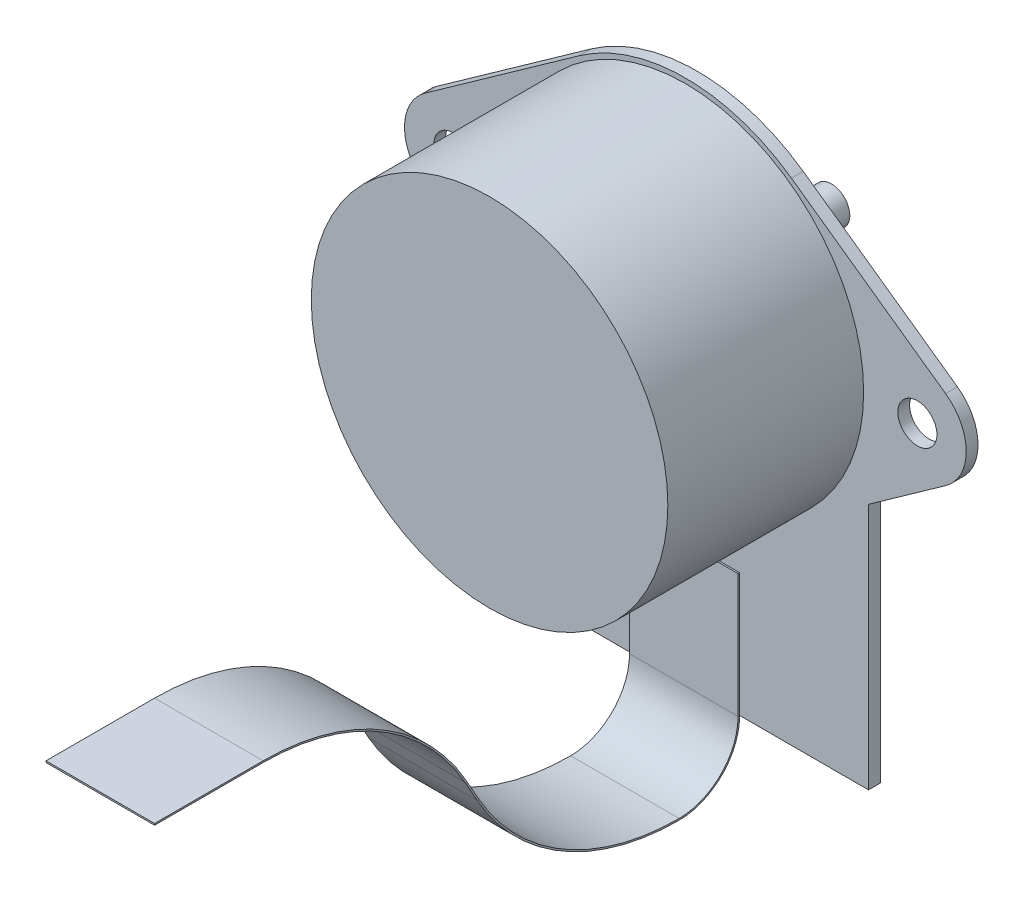
from build123d import *

# Parameters (mm, degrees)
SKETCH1_R           = 15
BOSS_EXTRUDE1_DEPTH = 0.9652
SKETCH2_R           = 1.6
BOSS_EXTRUDE2_DEPTH = 0.9652
SKETCH3_W           = 30
SKETCH3_H           = 26
BOSS_EXTRUDE3_DEPTH = 0.9652
SKETCH4_R           = 14.6
BOSS_EXTRUDE4_DEPTH = 16.0348
SKETCH5_R           = 1.5
BOSS_EXTRUDE5_DEPTH = 11
SKETCH6_R           = 7
BOSS_EXTRUDE6_DEPTH = 2
BOSS_EXTRUDE7_DEPTH = 4.445


with BuildPart() as part:
    # Sketch1 → Boss-Extrude1 (new body)
    with BuildSketch(Plane.XY):
        with Locations(Location((0, 0, 0), (0, 0, 180))):
            Circle(SKETCH1_R)
    extrude(amount=BOSS_EXTRUDE1_DEPTH)

    # Sketch2 → Boss-Extrude2 (add, through all)
    with BuildSketch(Plane.XY.offset(0.9652)):
        with BuildLine():
            Line((-21.315789474, 3.26145966), (-8.684210526, 12.230473725))
            ThreePointArc((-8.684210526, 12.230473725), (0, 15), (8.684210526, 12.230473725))
            Line((8.684210526, 12.230473725), (21.315789474, 3.26145966))
            ThreePointArc((21.315789474, 3.26145966), (23, 0), (21.315789474, -3.26145966))
            Line((21.315789474, -3.26145966), (8.684210526, -12.230473725))
            ThreePointArc((8.684210526, -12.230473725), (0, -15), (-8.684210526, -12.230473725))
            Line((-8.684210526, -12.230473725), (-21.315789474, -3.26145966))
            ThreePointArc((-21.315789474, -3.26145966), (-23, 0), (-21.315789474, 3.26145966))
        make_face()
        with Locations((-19, 0)):
            Circle(SKETCH2_R, mode=Mode.SUBTRACT)
        with Locations((19, 0)):
            Circle(SKETCH2_R, mode=Mode.SUBTRACT)
    extrude(amount=-BOSS_EXTRUDE2_DEPTH)

    # Sketch3 → Boss-Extrude3 (add, through all)
    with BuildSketch(Plane.XY.offset(0.9652)):
        with Locations((0, -15)):
            Rectangle(SKETCH3_W, SKETCH3_H)
    extrude(amount=-BOSS_EXTRUDE3_DEPTH)

    # Sketch4 → Boss-Extrude4 (add)
    with BuildSketch(Plane.XY.offset(0.9652)):
        Circle(SKETCH4_R)
    extrude(amount=BOSS_EXTRUDE4_DEPTH)

    # Sketch5 → Boss-Extrude5 (add)
    with BuildSketch(Plane(origin=(0, 0, 0), x_dir=(-1, 0, 0), z_dir=(0, 0, -1))):
        with Locations(Location((0, 0, 0), (0, 0, 180))):
            Circle(SKETCH5_R)
    extrude(amount=BOSS_EXTRUDE5_DEPTH)

    # Sketch6 → Boss-Extrude6 (add)
    with BuildSketch(Plane(origin=(0, 0, 0), x_dir=(-1, 0, 0), z_dir=(0, 0, -1))):
        with Locations(Location((0, 0, 0), (0, 0, 180))):
            Circle(SKETCH6_R)
    extrude(amount=BOSS_EXTRUDE6_DEPTH)

    # Sketch7 → Boss-Extrude7 (add, symmetric)
    with BuildSketch(Plane(origin=(0, 0, 0), x_dir=(0, 0, -1), z_dir=(1, 0, 0))):
        with BuildLine():
            Line((-48.879875, -11.826), (-39.989875, -11.826))
            ThreePointArc((-39.989875, -11.826), (-30.420049501, -14.417177809), (-23.46493471, -21.482737995))
            Line((-23.46493471, -21.482737995), (-22.44314029, -23.296262005))
            ThreePointArc((-22.44314029, -23.296262005), (-15.488025499, -30.361822191), (-5.9182, -32.953))
            ThreePointArc((-5.9182, -32.953), (-2.415900113, -31.502299887), (-0.9652, -28))
            Line((-0.9652, -28), (-0.9652, -17.872983346))
            Line((-0.9652, -17.872983346), (-1.0922, -17.872983346))
            Line((-1.0922, -17.872983346), (-1.0922, -28))
            ThreePointArc((-1.0922, -28), (-2.505702674, -31.412497326), (-5.9182, -32.826))
            ThreePointArc((-5.9182, -32.826), (-15.423948796, -30.252171946), (-22.332494209, -23.233920647))
            Line((-22.332494209, -23.233920647), (-23.35428863, -21.420396638))
            ThreePointArc((-23.35428863, -21.420396638), (-30.355972799, -14.307527564), (-39.989875, -11.699))
            Line((-39.989875, -11.699), (-48.879875, -11.699))
            Line((-48.879875, -11.699), (-48.879875, -11.826))
        make_face()
    extrude(amount=BOSS_EXTRUDE7_DEPTH, both=True)


solid = part.part
